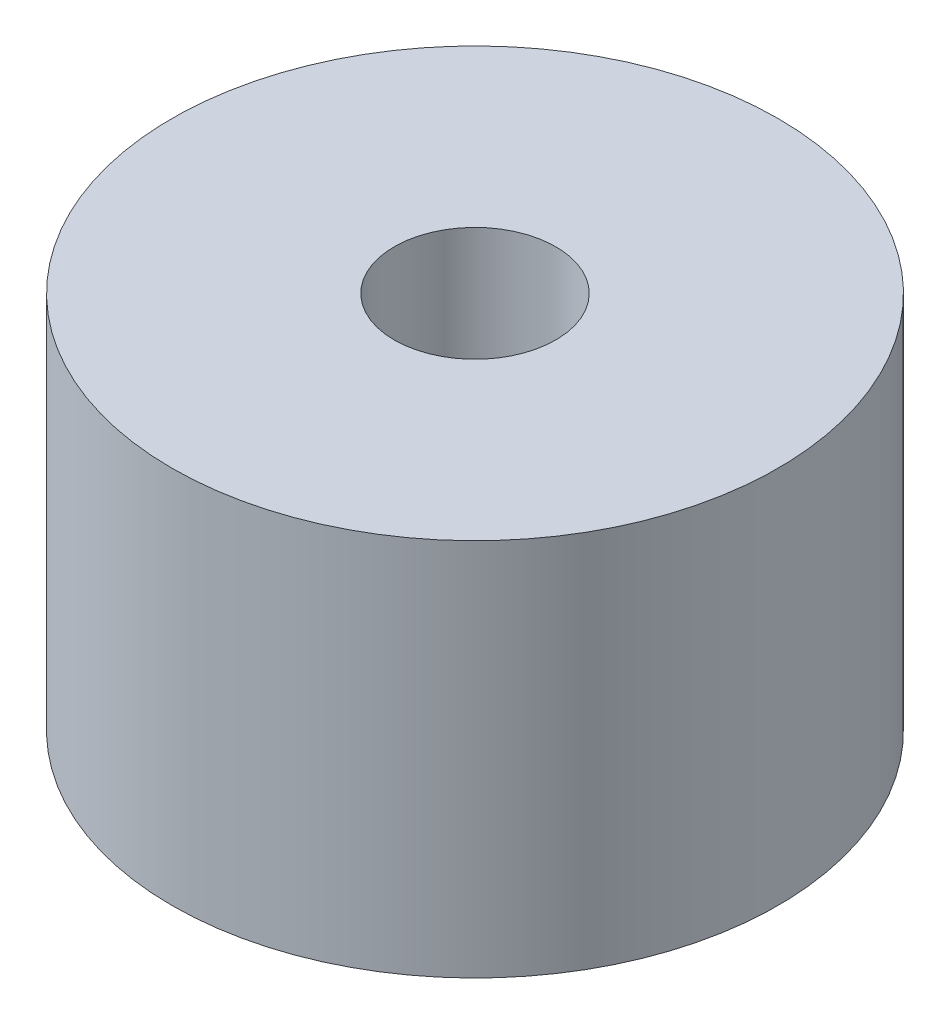
from build123d import *

# Parameters (mm, degrees)
SKETCH_1_R      = 6
SKETCH_1_R_2    = 1.6
EXTRUDE_1_DEPTH = 7.5


with BuildPart() as part:
    # 草图1 → 凸台-拉伸1 (new body)
    with BuildSketch(Plane(origin=(0, 0, 0), x_dir=(1, 0, 0), z_dir=(0, 1, 0))):
        with Locations(Location((0, 0, 0), (0, 0, 270))):
            Circle(SKETCH_1_R)
        with Locations(Location((0, 0, 0), (0, 0, 270))):
            Circle(SKETCH_1_R_2, mode=Mode.SUBTRACT)
    extrude(amount=EXTRUDE_1_DEPTH)


solid = part.part
